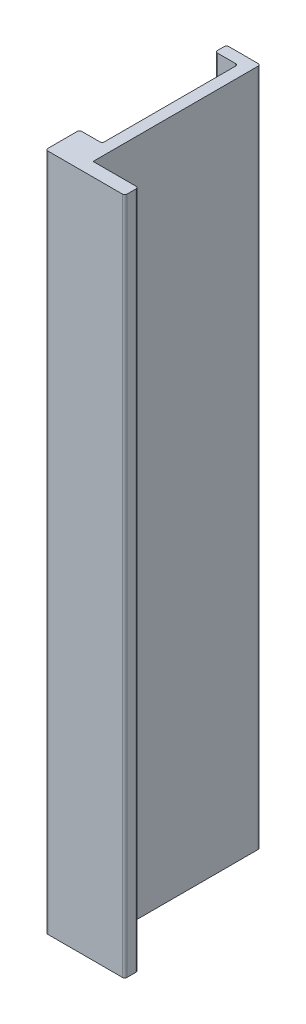
from build123d import *

# Parameters (mm, degrees)
SKETCH1_W           = 300
SKETCH1_H           = 80
BOSS_EXTRUDE1_DEPTH = 15
SKETCH2_W           = 300
SKETCH2_H           = 6
BOSS_EXTRUDE2_DEPTH = 20
SKETCH3_W           = 300
SKETCH3_H           = 60
CUT_EXTRUDE1_DEPTH  = 10
FILLET1_R           = 1


with BuildPart() as part:
    # Sketch1 → Boss-Extrude1 (new body)
    with BuildSketch(Plane.YZ):
        with Locations((150, -40)):
            Rectangle(SKETCH1_W, SKETCH1_H)
    extrude(amount=BOSS_EXTRUDE1_DEPTH)

    # Sketch2 → Boss-Extrude2 (add)
    with BuildSketch(Plane.YZ.offset(15)):
        with Locations((150, -3)):
            Rectangle(SKETCH2_W, SKETCH2_H)
    extrude(amount=BOSS_EXTRUDE2_DEPTH)

    # Sketch3 → Cut-Extrude1 (cut)
    with BuildSketch(Plane(origin=(0, 0, 0), x_dir=(0, -1, 0), z_dir=(-1, 0, 0))):
        with Locations((-150, -45)):
            Rectangle(SKETCH3_W, SKETCH3_H)
    extrude(amount=-CUT_EXTRUDE1_DEPTH, mode=Mode.SUBTRACT)

    # Fillet1
    fillet1_edges = [part.edges().sort_by_distance(p)[0] for p in [
        (35, 150, -6),
        (35, 150, 0),
        (10, 150, -15),
        (10, 150, -75),
        (0, 150, -75),
        (0, 150, -15),
        (0, 150, 0),
        (0, 150, -80),
        (15, 150, -80),
    ]]
    fillet(fillet1_edges, radius=FILLET1_R)


solid = part.part
